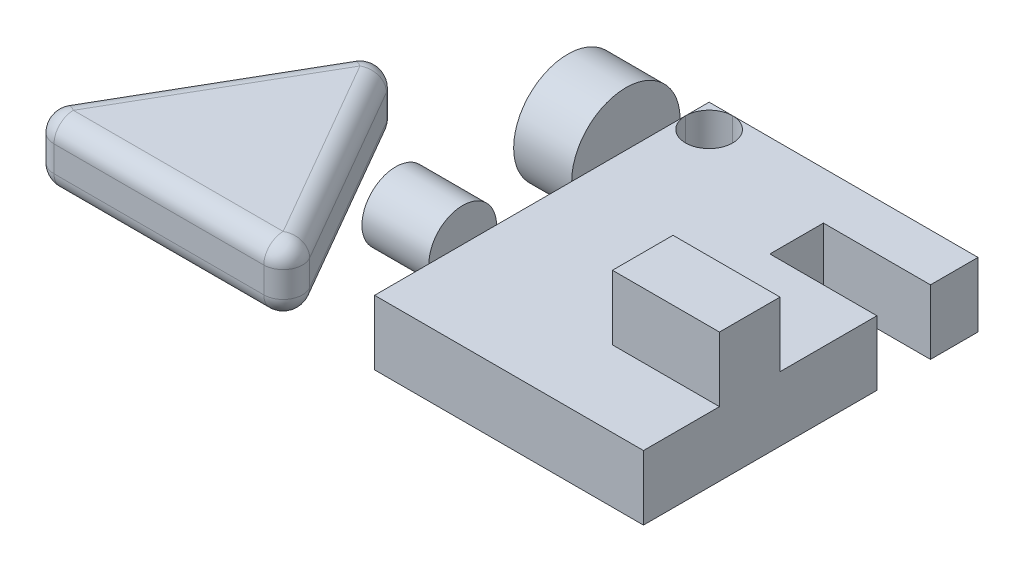
from build123d import *

# Parameters (mm, degrees)
EXTRUDE_1_DEPTH     = 10
FILLET_1_R          = 3
SKETCH_5_W          = 41.61122563
SKETCH_5_H          = 51.770488075
EXTRUDE_2_DEPTH     = 10
SKETCH_6_W          = 8.984872988
SKETCH_6_H          = 8.385188636
SKETCH_7_W          = 10.365962881
SKETCH_7_H          = 5.228411738
SKETCH_8_W          = 16.562097684
SKETCH_8_H          = 8.286539358
CUT_EXTRUDE_1_DEPTH = 10
SKETCH_8_4_W        = 16.562097684
SKETCH_8_4_H        = 9.371681417
EXTRUDE_3_DEPTH     = 10
SKETCH_10_R         = 3.650023289
CUT_EXTRUDE_3_DEPTH = 10


with BuildPart() as part:
    # 草图1 → 凸台-拉伸1 (new body)
    with BuildSketch(Plane(origin=(0, 0, 0), x_dir=(1, 0, 0), z_dir=(0, 1, 0))):
        Polygon((0, 0), (42.860249516, 0), (21.430124758, 37.118064893), align=None)
    extrude(amount=EXTRUDE_1_DEPTH)

    # 圆角1
    fillet_1_edges = [part.edges().sort_by_distance(p)[0] for p in [
        (21.430124758, 0, 0),
        (32.145187137, 0, -18.559032447),
        (10.715062379, 0, -18.559032447),
        (32.145187137, 10, -18.559032447),
        (21.430124758, 10, 0),
        (10.715062379, 10, -18.559032447),
        (0, 5, 0),
        (42.860249516, 5, 0),
        (21.430124758, 5, -37.118064893),
    ]]
    fillet(fillet_1_edges, radius=FILLET_1_R)


with BuildPart() as body_2:
    # 草图5 → 凸台-拉伸2 (new body)
    with BuildSketch(Plane(origin=(0, 0, 0), x_dir=(1, 0, 0), z_dir=(0, 1, 0))):
        with Locations((74.09889893, 27.401236686)):
            Rectangle(SKETCH_5_W, SKETCH_5_H)
    extrude(amount=EXTRUDE_2_DEPTH)

    # 草图6 → 旋转1 (revolve)
    with BuildSketch(Plane(origin=(0, 10, 0), x_dir=(1, 0, 0), z_dir=(0, 1, 0))):
        with Locations((48.800849621, 44.597408971)):
            Rectangle(SKETCH_6_W, SKETCH_6_H)
    revolve(axis=Axis((44.308413127, 10, -40.404814653), (1, 0, 0)))

    # 草图7 → 旋转2 (revolve)
    with BuildSketch(Plane(origin=(0, 10, 0), x_dir=(1, 0, 0), z_dir=(0, 1, 0))):
        with Locations((48.110304675, 17.764805335)):
            Rectangle(SKETCH_7_W, SKETCH_7_H)
    revolve(axis=Axis((42.927323234, 10, -15.150599466), (1, 0, 0)))

    # 草图8 → 切除-拉伸1 (cut)
    with BuildSketch(Plane(origin=(0, 10, 0), x_dir=(1, 0, 0), z_dir=(0, 1, 0))):
        with Locations((86.623462903, 41.785904546)):
            Rectangle(SKETCH_8_W, SKETCH_8_H)
    extrude(amount=-CUT_EXTRUDE_1_DEPTH, mode=Mode.SUBTRACT)

    # 草图8<4> → 凸台-拉伸3 (add)
    with BuildSketch(Plane(origin=(0, 10, 0), x_dir=(1, 0, 0), z_dir=(0, 1, 0))):
        with Locations((86.623462903, 17.962103891)):
            Rectangle(SKETCH_8_4_W, SKETCH_8_4_H)
    extrude(amount=EXTRUDE_3_DEPTH)

    # 草图10 → 切除-拉伸3 (cut)
    with BuildSketch(Plane(origin=(0, 10, 0), x_dir=(1, 0, 0), z_dir=(0, 1, 0))):
        with Locations((56.943309403, 49.636457434)):
            Circle(SKETCH_10_R)
    extrude(amount=-CUT_EXTRUDE_3_DEPTH, mode=Mode.SUBTRACT)


with BuildPart() as cut_extrude_3_piece_1:
    # of the separate pieces the step leaves, piece 1, a body of its own (cut_extrude_3_pieces)
    add(body_2.part.solids().sort_by_distance((53.293286115, 0, -1.515992648))[0])


with BuildPart() as cut_extrude_3_piece_2:
    # of the separate pieces the step leaves, piece 2, a body of its own (cut_extrude_3_pieces)
    add(body_2.part.solids().sort_by_distance((53.293286115, 0, -53.286480723))[0])


solid = Compound([part.part, cut_extrude_3_piece_1.part, cut_extrude_3_piece_2.part])
